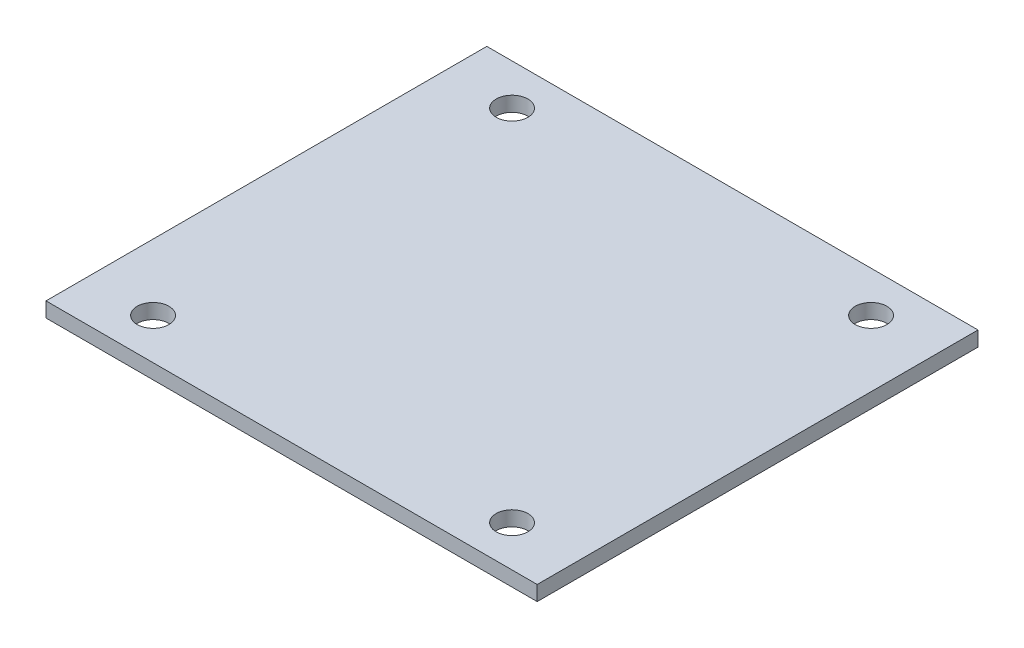
from build123d import *

# Parameters (mm, degrees)
SKETCH1_W           = 49.53
SKETCH1_H           = 44.45
SKETCH1_R           = 1.6
BOSS_EXTRUDE1_DEPTH = 1.5


with BuildPart() as part:
    # Sketch1 → Boss-Extrude1 (new body)
    with BuildSketch(Plane(origin=(0, 0, 0), x_dir=(1, 0, 0), z_dir=(0, 1, 0))):
        with Locations((24.765, 22.225)):
            Rectangle(SKETCH1_W, SKETCH1_H)
        with Locations(Location((6.6675, 4.1275, 0), (0, 0, 270))):
            Circle(SKETCH1_R, mode=Mode.SUBTRACT)
        with Locations(Location((42.8675, 4.1275, 0), (0, 0, 270))):
            Circle(SKETCH1_R, mode=Mode.SUBTRACT)
        with Locations(Location((42.8675, 40.3275, 0), (0, 0, 270))):
            Circle(SKETCH1_R, mode=Mode.SUBTRACT)
        with Locations(Location((6.6675, 40.3275, 0), (0, 0, 270))):
            Circle(SKETCH1_R, mode=Mode.SUBTRACT)
    extrude(amount=BOSS_EXTRUDE1_DEPTH)


solid = part.part
